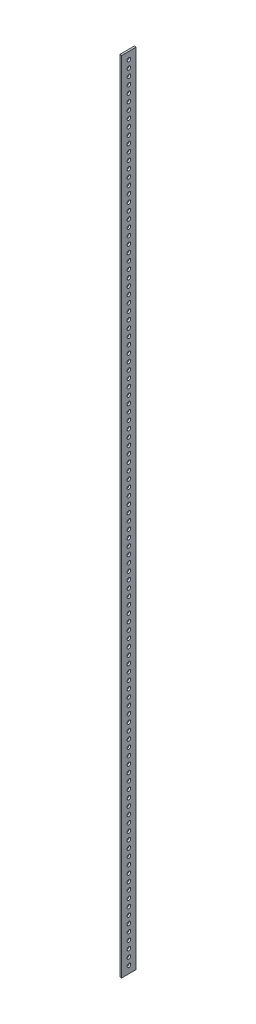
from build123d import *

# Parameters (mm, degrees)
SKETCH1_W           = 25.4
SKETCH1_H           = 1397
SKETCH1_R           = 3.175
BOSS_EXTRUDE1_DEPTH = 3.175


with BuildPart() as part:
    # Sketch1 → Boss-Extrude1 (new body)
    with BuildSketch(Plane(origin=(0, 0, 0), x_dir=(0, 0, -1), z_dir=(1, 0, 0))):
        Rectangle(SKETCH1_W, SKETCH1_H)
        with Locations((0, -685.8)):
            Circle(SKETCH1_R, mode=Mode.SUBTRACT)
        with Locations((0, -673.1)):
            Circle(SKETCH1_R, mode=Mode.SUBTRACT)
        with Locations((0, -660.4)):
            Circle(SKETCH1_R, mode=Mode.SUBTRACT)
        with Locations((0, -647.7)):
            Circle(SKETCH1_R, mode=Mode.SUBTRACT)
        with Locations((0, -635)):
            Circle(SKETCH1_R, mode=Mode.SUBTRACT)
        with Locations((0, -622.3)):
            Circle(SKETCH1_R, mode=Mode.SUBTRACT)
        with Locations((0, -609.6)):
            Circle(SKETCH1_R, mode=Mode.SUBTRACT)
        with Locations((0, -596.9)):
            Circle(SKETCH1_R, mode=Mode.SUBTRACT)
        with Locations((0, -584.2)):
            Circle(SKETCH1_R, mode=Mode.SUBTRACT)
        with Locations((0, -571.5)):
            Circle(SKETCH1_R, mode=Mode.SUBTRACT)
        with Locations((0, -558.8)):
            Circle(SKETCH1_R, mode=Mode.SUBTRACT)
        with Locations((0, -546.1)):
            Circle(SKETCH1_R, mode=Mode.SUBTRACT)
        with Locations((0, -533.4)):
            Circle(SKETCH1_R, mode=Mode.SUBTRACT)
        with Locations((0, -520.7)):
            Circle(SKETCH1_R, mode=Mode.SUBTRACT)
        with Locations((0, -508)):
            Circle(SKETCH1_R, mode=Mode.SUBTRACT)
        with Locations((0, -495.3)):
            Circle(SKETCH1_R, mode=Mode.SUBTRACT)
        with Locations((0, -482.6)):
            Circle(SKETCH1_R, mode=Mode.SUBTRACT)
        with Locations((0, -469.9)):
            Circle(SKETCH1_R, mode=Mode.SUBTRACT)
        with Locations((0, -457.2)):
            Circle(SKETCH1_R, mode=Mode.SUBTRACT)
        with Locations((0, -444.5)):
            Circle(SKETCH1_R, mode=Mode.SUBTRACT)
        with Locations((0, -431.8)):
            Circle(SKETCH1_R, mode=Mode.SUBTRACT)
        with Locations((0, -419.1)):
            Circle(SKETCH1_R, mode=Mode.SUBTRACT)
        with Locations((0, -406.4)):
            Circle(SKETCH1_R, mode=Mode.SUBTRACT)
        with Locations((0, -393.7)):
            Circle(SKETCH1_R, mode=Mode.SUBTRACT)
        with Locations((0, -381)):
            Circle(SKETCH1_R, mode=Mode.SUBTRACT)
        with Locations((0, -368.3)):
            Circle(SKETCH1_R, mode=Mode.SUBTRACT)
        with Locations((0, -355.6)):
            Circle(SKETCH1_R, mode=Mode.SUBTRACT)
        with Locations((0, -342.9)):
            Circle(SKETCH1_R, mode=Mode.SUBTRACT)
        with Locations((0, -330.2)):
            Circle(SKETCH1_R, mode=Mode.SUBTRACT)
        with Locations((0, -317.5)):
            Circle(SKETCH1_R, mode=Mode.SUBTRACT)
        with Locations((0, -304.8)):
            Circle(SKETCH1_R, mode=Mode.SUBTRACT)
        with Locations((0, -292.1)):
            Circle(SKETCH1_R, mode=Mode.SUBTRACT)
        with Locations((0, -279.4)):
            Circle(SKETCH1_R, mode=Mode.SUBTRACT)
        with Locations((0, -266.7)):
            Circle(SKETCH1_R, mode=Mode.SUBTRACT)
        with Locations((0, -254)):
            Circle(SKETCH1_R, mode=Mode.SUBTRACT)
        with Locations((0, -241.3)):
            Circle(SKETCH1_R, mode=Mode.SUBTRACT)
        with Locations((0, -228.6)):
            Circle(SKETCH1_R, mode=Mode.SUBTRACT)
        with Locations((0, -215.9)):
            Circle(SKETCH1_R, mode=Mode.SUBTRACT)
        with Locations((0, -203.2)):
            Circle(SKETCH1_R, mode=Mode.SUBTRACT)
        with Locations((0, -190.5)):
            Circle(SKETCH1_R, mode=Mode.SUBTRACT)
        with Locations((0, -177.8)):
            Circle(SKETCH1_R, mode=Mode.SUBTRACT)
        with Locations((0, -165.1)):
            Circle(SKETCH1_R, mode=Mode.SUBTRACT)
        with Locations((0, -152.4)):
            Circle(SKETCH1_R, mode=Mode.SUBTRACT)
        with Locations((0, -139.7)):
            Circle(SKETCH1_R, mode=Mode.SUBTRACT)
        with Locations((0, -127)):
            Circle(SKETCH1_R, mode=Mode.SUBTRACT)
        with Locations((0, -114.3)):
            Circle(SKETCH1_R, mode=Mode.SUBTRACT)
        with Locations((0, -101.6)):
            Circle(SKETCH1_R, mode=Mode.SUBTRACT)
        with Locations((0, -88.9)):
            Circle(SKETCH1_R, mode=Mode.SUBTRACT)
        with Locations((0, -76.2)):
            Circle(SKETCH1_R, mode=Mode.SUBTRACT)
        with Locations((0, -63.5)):
            Circle(SKETCH1_R, mode=Mode.SUBTRACT)
        with Locations((0, -50.8)):
            Circle(SKETCH1_R, mode=Mode.SUBTRACT)
        with Locations((0, -38.1)):
            Circle(SKETCH1_R, mode=Mode.SUBTRACT)
        with Locations((0, -25.4)):
            Circle(SKETCH1_R, mode=Mode.SUBTRACT)
        with Locations((0, -12.7)):
            Circle(SKETCH1_R, mode=Mode.SUBTRACT)
        Circle(SKETCH1_R, mode=Mode.SUBTRACT)
        with Locations((0, 12.7)):
            Circle(SKETCH1_R, mode=Mode.SUBTRACT)
        with Locations((0, 25.4)):
            Circle(SKETCH1_R, mode=Mode.SUBTRACT)
        with Locations((0, 38.1)):
            Circle(SKETCH1_R, mode=Mode.SUBTRACT)
        with Locations((0, 50.8)):
            Circle(SKETCH1_R, mode=Mode.SUBTRACT)
        with Locations((0, 63.5)):
            Circle(SKETCH1_R, mode=Mode.SUBTRACT)
        with Locations((0, 76.2)):
            Circle(SKETCH1_R, mode=Mode.SUBTRACT)
        with Locations((0, 88.9)):
            Circle(SKETCH1_R, mode=Mode.SUBTRACT)
        with Locations((0, 101.6)):
            Circle(SKETCH1_R, mode=Mode.SUBTRACT)
        with Locations((0, 114.3)):
            Circle(SKETCH1_R, mode=Mode.SUBTRACT)
        with Locations((0, 127)):
            Circle(SKETCH1_R, mode=Mode.SUBTRACT)
        with Locations((0, 139.7)):
            Circle(SKETCH1_R, mode=Mode.SUBTRACT)
        with Locations((0, 152.4)):
            Circle(SKETCH1_R, mode=Mode.SUBTRACT)
        with Locations((0, 165.1)):
            Circle(SKETCH1_R, mode=Mode.SUBTRACT)
        with Locations((0, 177.8)):
            Circle(SKETCH1_R, mode=Mode.SUBTRACT)
        with Locations((0, 190.5)):
            Circle(SKETCH1_R, mode=Mode.SUBTRACT)
        with Locations((0, 203.2)):
            Circle(SKETCH1_R, mode=Mode.SUBTRACT)
        with Locations((0, 215.9)):
            Circle(SKETCH1_R, mode=Mode.SUBTRACT)
        with Locations((0, 228.6)):
            Circle(SKETCH1_R, mode=Mode.SUBTRACT)
        with Locations((0, 241.3)):
            Circle(SKETCH1_R, mode=Mode.SUBTRACT)
        with Locations((0, 254)):
            Circle(SKETCH1_R, mode=Mode.SUBTRACT)
        with Locations((0, 266.7)):
            Circle(SKETCH1_R, mode=Mode.SUBTRACT)
        with Locations((0, 279.4)):
            Circle(SKETCH1_R, mode=Mode.SUBTRACT)
        with Locations((0, 292.1)):
            Circle(SKETCH1_R, mode=Mode.SUBTRACT)
        with Locations((0, 304.8)):
            Circle(SKETCH1_R, mode=Mode.SUBTRACT)
        with Locations((0, 317.5)):
            Circle(SKETCH1_R, mode=Mode.SUBTRACT)
        with Locations((0, 330.2)):
            Circle(SKETCH1_R, mode=Mode.SUBTRACT)
        with Locations((0, 342.9)):
            Circle(SKETCH1_R, mode=Mode.SUBTRACT)
        with Locations((0, 355.6)):
            Circle(SKETCH1_R, mode=Mode.SUBTRACT)
        with Locations((0, 368.3)):
            Circle(SKETCH1_R, mode=Mode.SUBTRACT)
        with Locations((0, 381)):
            Circle(SKETCH1_R, mode=Mode.SUBTRACT)
        with Locations((0, 393.7)):
            Circle(SKETCH1_R, mode=Mode.SUBTRACT)
        with Locations((0, 406.4)):
            Circle(SKETCH1_R, mode=Mode.SUBTRACT)
        with Locations((0, 419.1)):
            Circle(SKETCH1_R, mode=Mode.SUBTRACT)
        with Locations((0, 431.8)):
            Circle(SKETCH1_R, mode=Mode.SUBTRACT)
        with Locations((0, 444.5)):
            Circle(SKETCH1_R, mode=Mode.SUBTRACT)
        with Locations((0, 457.2)):
            Circle(SKETCH1_R, mode=Mode.SUBTRACT)
        with Locations((0, 469.9)):
            Circle(SKETCH1_R, mode=Mode.SUBTRACT)
        with Locations((0, 482.6)):
            Circle(SKETCH1_R, mode=Mode.SUBTRACT)
        with Locations((0, 495.3)):
            Circle(SKETCH1_R, mode=Mode.SUBTRACT)
        with Locations((0, 508)):
            Circle(SKETCH1_R, mode=Mode.SUBTRACT)
        with Locations((0, 520.7)):
            Circle(SKETCH1_R, mode=Mode.SUBTRACT)
        with Locations((0, 533.4)):
            Circle(SKETCH1_R, mode=Mode.SUBTRACT)
        with Locations((0, 546.1)):
            Circle(SKETCH1_R, mode=Mode.SUBTRACT)
        with Locations((0, 558.8)):
            Circle(SKETCH1_R, mode=Mode.SUBTRACT)
        with Locations((0, 571.5)):
            Circle(SKETCH1_R, mode=Mode.SUBTRACT)
        with Locations((0, 584.2)):
            Circle(SKETCH1_R, mode=Mode.SUBTRACT)
        with Locations((0, 596.9)):
            Circle(SKETCH1_R, mode=Mode.SUBTRACT)
        with Locations((0, 609.6)):
            Circle(SKETCH1_R, mode=Mode.SUBTRACT)
        with Locations((0, 622.3)):
            Circle(SKETCH1_R, mode=Mode.SUBTRACT)
        with Locations((0, 635)):
            Circle(SKETCH1_R, mode=Mode.SUBTRACT)
        with Locations((0, 647.7)):
            Circle(SKETCH1_R, mode=Mode.SUBTRACT)
        with Locations((0, 660.4)):
            Circle(SKETCH1_R, mode=Mode.SUBTRACT)
        with Locations((0, 673.1)):
            Circle(SKETCH1_R, mode=Mode.SUBTRACT)
        with Locations((0, 685.8)):
            Circle(SKETCH1_R, mode=Mode.SUBTRACT)
    extrude(amount=BOSS_EXTRUDE1_DEPTH)


solid = part.part
